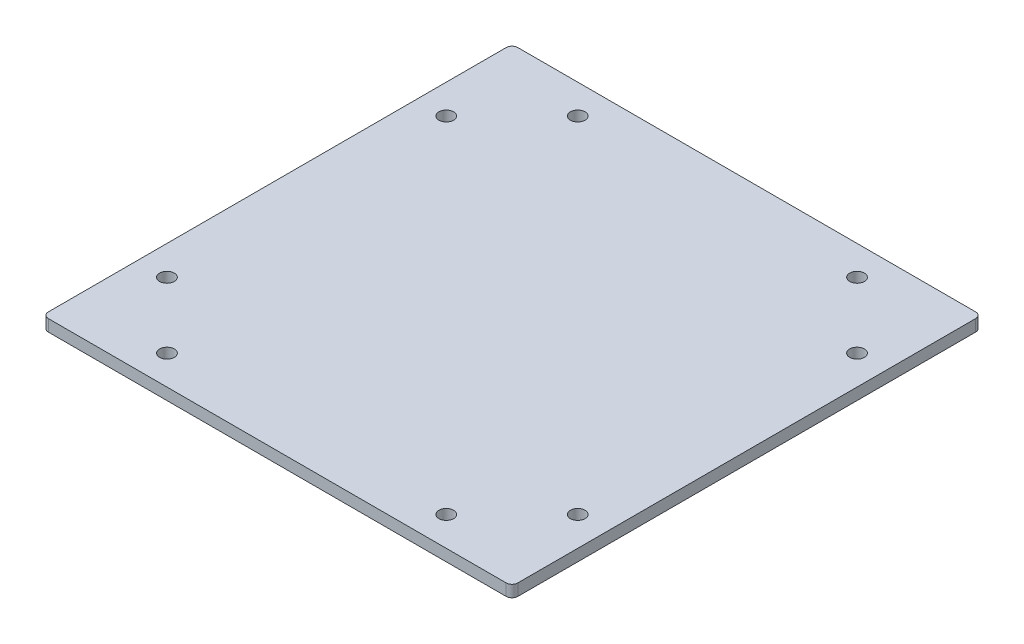
from build123d import *

# Parameters (mm, degrees)
SKETCH1_R           = 3.175
BOSS_EXTRUDE1_DEPTH = 5.08


with BuildPart() as part:
    # Sketch1 → Boss-Extrude1 (new body)
    with BuildSketch(Plane(origin=(0, 0, 0), x_dir=(1, 0, 0), z_dir=(0, 1, 0))):
        with BuildLine():
            Line((-99.06, -101.6), (99.06, -101.6))
            ThreePointArc((99.06, -101.6), (100.856051224, -100.856051224), (101.6, -99.06))
            Line((101.6, -99.06), (101.6, 99.06))
            ThreePointArc((101.6, 99.06), (100.856051224, 100.856051224), (99.06, 101.6))
            Line((99.06, 101.6), (-99.06, 101.6))
            ThreePointArc((-99.06, 101.6), (-100.856051224, 100.856051224), (-101.6, 99.06))
            Line((-101.6, 99.06), (-101.6, -99.06))
            ThreePointArc((-101.6, -99.06), (-100.856051224, -100.856051224), (-99.06, -101.6))
        make_face()
        with Locations(Location((-60.452, -88.9, 0), (0, 0, 270))):
            Circle(SKETCH1_R, mode=Mode.SUBTRACT)
        with Locations(Location((-88.9, -60.452, 0), (0, 0, 90))):
            Circle(SKETCH1_R, mode=Mode.SUBTRACT)
        with Locations(Location((88.9, 60.452, 0), (0, 0, 90))):
            Circle(SKETCH1_R, mode=Mode.SUBTRACT)
        with Locations(Location((60.452, 88.9, 0), (0, 0, 270))):
            Circle(SKETCH1_R, mode=Mode.SUBTRACT)
        with Locations(Location((-60.452, 88.9, 0), (0, 0, 90))):
            Circle(SKETCH1_R, mode=Mode.SUBTRACT)
        with Locations(Location((-88.9, 60.452, 0), (0, 0, 270))):
            Circle(SKETCH1_R, mode=Mode.SUBTRACT)
        with Locations(Location((60.452, -88.9, 0), (0, 0, 90))):
            Circle(SKETCH1_R, mode=Mode.SUBTRACT)
        with Locations(Location((88.9, -60.452, 0), (0, 0, 270))):
            Circle(SKETCH1_R, mode=Mode.SUBTRACT)
    extrude(amount=BOSS_EXTRUDE1_DEPTH)


solid = part.part
